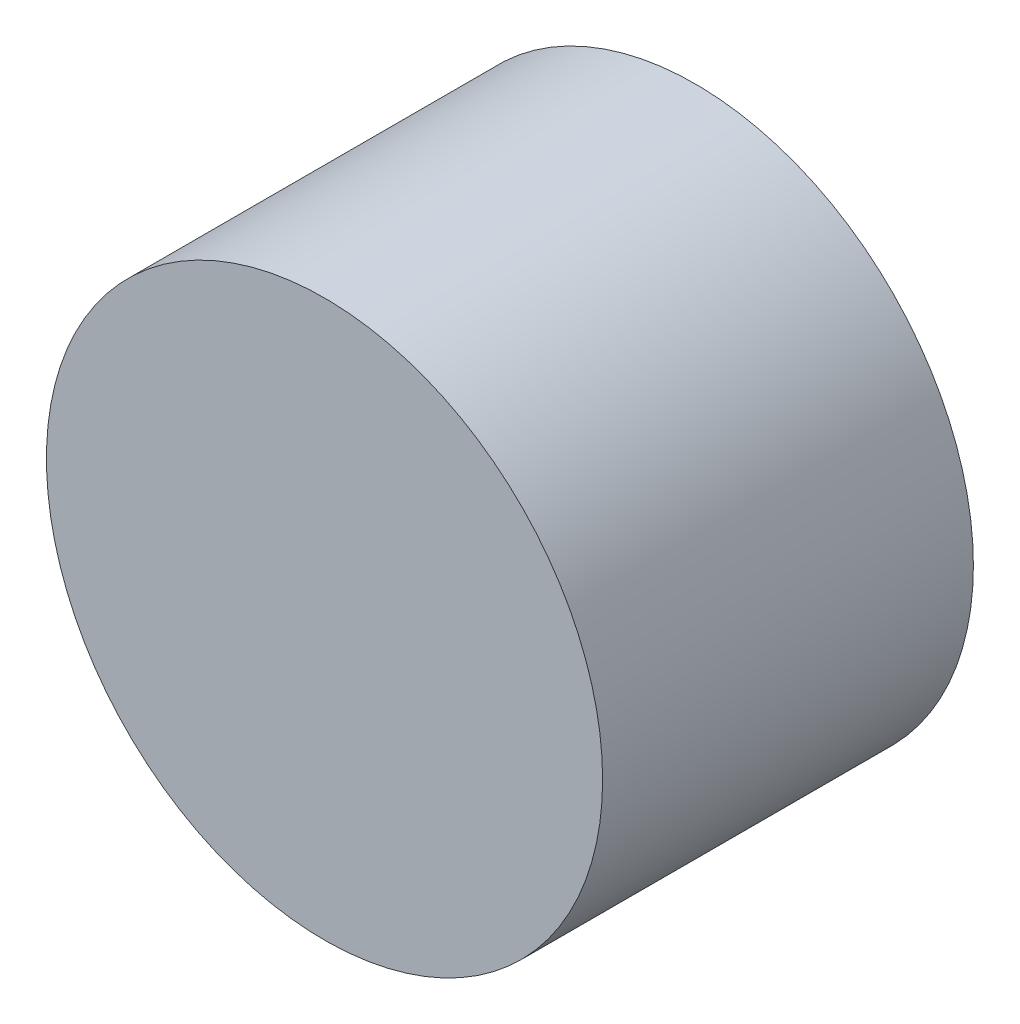
from build123d import *

# Parameters (mm, degrees)
SKETCH_1_R      = 18
EXTRUDE_1_DEPTH = 24


with BuildPart() as part:
    # 草图1 → 凸台-拉伸1 (new body)
    with BuildSketch(Plane.XY):
        Circle(SKETCH_1_R)
    extrude(amount=EXTRUDE_1_DEPTH)


solid = part.part
